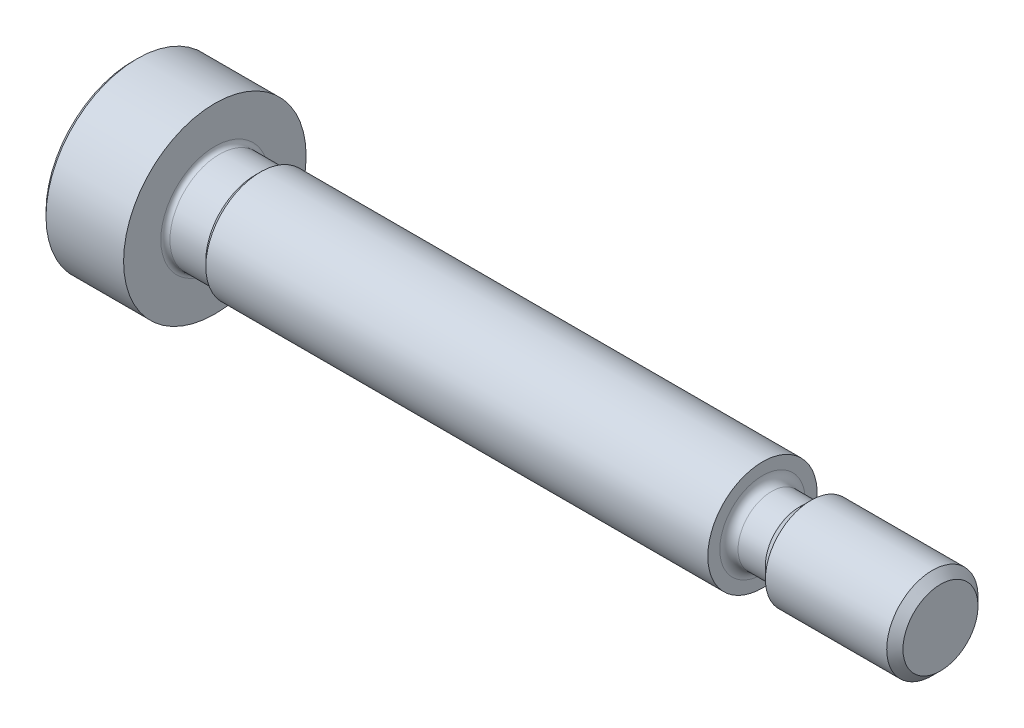
from build123d import *

# Parameters (mm, degrees)
CHAMFER1_SIZE = 0.25
HEX_2_DEPTH   = 2.4


with BuildPart() as part:
    # BodySke → BaseBody (revolve)
    with BuildSketch(Plane.XY, mode=Mode.PRIVATE) as basebody_sk:
        with BuildLine():
            Line((0, 0), (0, 5))
            Line((0, 5), (4.5, 5))
            Line((4.5, 5), (4.5, 2.96))
            ThreePointArc((4.5, 2.96), (4.573223305, 2.783223305), (4.75, 2.71))
            Line((4.75, 2.71), (6.715, 2.71))
            Line((6.715, 2.71), (7, 2.995))
            Line((7, 2.995), (34.5, 2.995))
            Line((34.5, 2.995), (34.5, 2.34))
            ThreePointArc((34.5, 2.34), (34.646446609, 1.986446609), (35, 1.84))
            Line((35, 1.84), (36.5, 1.84))
            Line((36.5, 1.84), (37.16, 2.5))
            Line((37.16, 2.5), (43.805, 2.5))
            Line((43.805, 2.5), (44.25, 2.055))
            Line((44.25, 2.055), (44.25, 0))
            Line((44.25, 0), (0, 0))
        make_face()
    revolve(basebody_sk.sketch.rotate(Axis((-6.35, 0, 0), (1, 0, 0)), 90), axis=Axis((-6.35, 0, 0), (1, 0, 0)))

    # Chamfer1
    chamfer1_edges = [part.edges().sort_by_distance(p)[0] for p in [
        (0, 0, -5),
    ]]
    chamfer(chamfer1_edges, length=CHAMFER1_SIZE)

    # Sketch2 → PreBroach (revolve, cut)
    with BuildSketch(Plane.XY, mode=Mode.PRIVATE) as prebroach_sk:
        Polygon((0, 1.54), (2.4, 1.54), (3.289119415, 0), (0, 0), align=None)
    revolve(prebroach_sk.sketch.rotate(Axis((0, 0, 0), (1, 0, 0)), 90), axis=Axis((0, 0, 0), (1, 0, 0)), mode=Mode.SUBTRACT)

    # Sketch3 → Hex 2 (cut)
    with BuildSketch(Plane.ZY):
        Polygon((-1.54, -0.889119415), (-1.54, 0.889119415), (0, 1.778238829), (1.54, 0.889119415), (1.54, -0.889119415), (0, -1.778238829), align=None)
    extrude(amount=-HEX_2_DEPTH, mode=Mode.SUBTRACT)


solid = part.part
